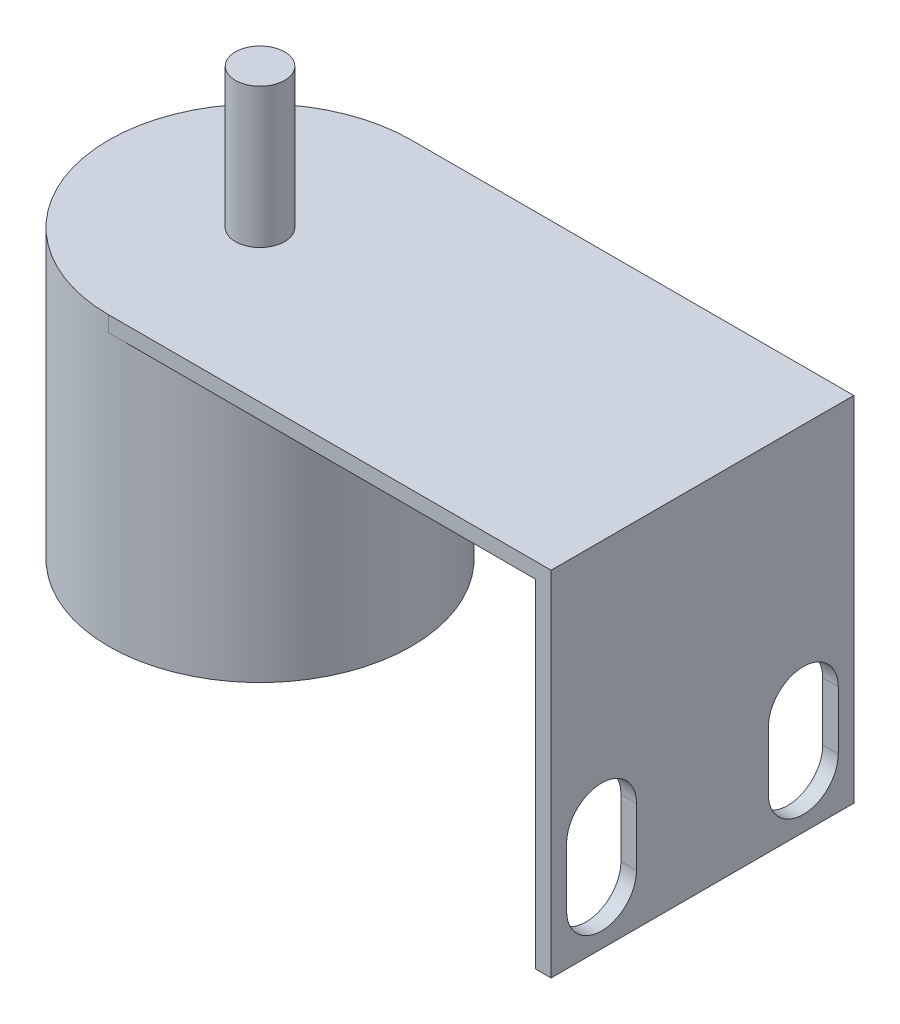
from build123d import *

# Parameters (mm, degrees)
ESQUISSE1_R             = 19.5
BOSS_EXTRU_1_DEPTH      = 35
ESQUISSE2_R             = 3.175
BOSS_EXTRU_2_DEPTH      = 20
BOSS_EXTRU_3_DEPTH      = 2
ESQUISSE5_W             = 2
ESQUISSE5_H             = 39
BOSS_EXTRU_4_DEPTH      = 43.5
ENL_V_MAT_EXTRU_1_DEPTH = 5


with BuildPart() as part:
    # Esquisse1 → Boss.-Extru.1 (new body)
    with BuildSketch(Plane(origin=(0, 0, 0), x_dir=(1, 0, 0), z_dir=(0, 1, 0))):
        with Locations(Location((0, 0, 0), (0, 0, 270))):
            Circle(ESQUISSE1_R)
    extrude(amount=BOSS_EXTRU_1_DEPTH)

    # Esquisse2 → Boss.-Extru.2 (add)
    with BuildSketch(Plane(origin=(0, 35, 0), x_dir=(1, 0, 0), z_dir=(0, 1, 0))):
        with Locations(Location((0, 0, 0), (0, 0, 270))):
            Circle(ESQUISSE2_R)
    extrude(amount=BOSS_EXTRU_2_DEPTH)

    # Esquisse4 → Boss.-Extru.3 (add)
    with BuildSketch(Plane(origin=(0, 35, 0), x_dir=(1, 0, 0), z_dir=(0, 1, 0))):
        with BuildLine():
            Line((0, 19.5), (57, 19.5))
            Line((57, 19.5), (57, -19.5))
            Line((57, -19.5), (0, -19.5))
            ThreePointArc((0, -19.5), (-19.5, 0), (0, 19.5))
        make_face()
    extrude(amount=BOSS_EXTRU_3_DEPTH)

    # Esquisse5 → Boss.-Extru.4 (add)
    with BuildSketch(Plane.XZ.offset(-35)):
        with Locations((56, 0)):
            Rectangle(ESQUISSE5_W, ESQUISSE5_H)
    extrude(amount=BOSS_EXTRU_4_DEPTH)

    # Esquisse6 → Enlèv. mat.-Extru.1 (cut)
    with BuildSketch(Plane(origin=(57, 0, 0), x_dir=(0, 0, -1), z_dir=(1, 0, 0))):
        with BuildLine():
            Line((-8.5, 5.5), (-8.5, -2))
            ThreePointArc((-8.5, -2), (-13, -6.5), (-17.5, -2))
            Line((-17.5, -2), (-17.5, 5.5))
            ThreePointArc((-17.5, 5.5), (-13, 10), (-8.5, 5.5))
        make_face()
        with BuildLine():
            Line((8.5, 5.5), (8.5, -2))
            ThreePointArc((8.5, -2), (13, -6.5), (17.5, -2))
            Line((17.5, -2), (17.5, 5.5))
            ThreePointArc((17.5, 5.5), (13, 10), (8.5, 5.5))
        make_face()
    extrude(amount=-ENL_V_MAT_EXTRU_1_DEPTH, mode=Mode.SUBTRACT)


solid = part.part
